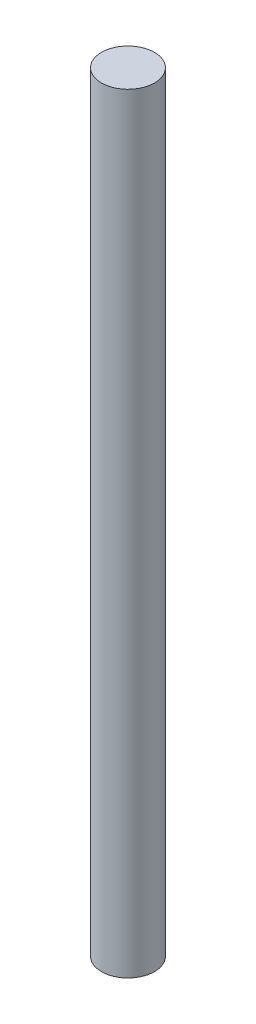
from build123d import *

# Parameters (mm, degrees)
SKETCH1_R           = 1.750000056
BOSS_EXTRUDE1_DEPTH = 50.8


with BuildPart() as part:
    # Sketch1 → Boss-Extrude1 (new body)
    with BuildSketch(Plane(origin=(0, 0, 0), x_dir=(1, 0, 0), z_dir=(0, 1, 0))):
        with Locations(Location((0, 0, 0), (0, 0, 270))):
            Circle(SKETCH1_R)
    extrude(amount=BOSS_EXTRUDE1_DEPTH)


solid = part.part
